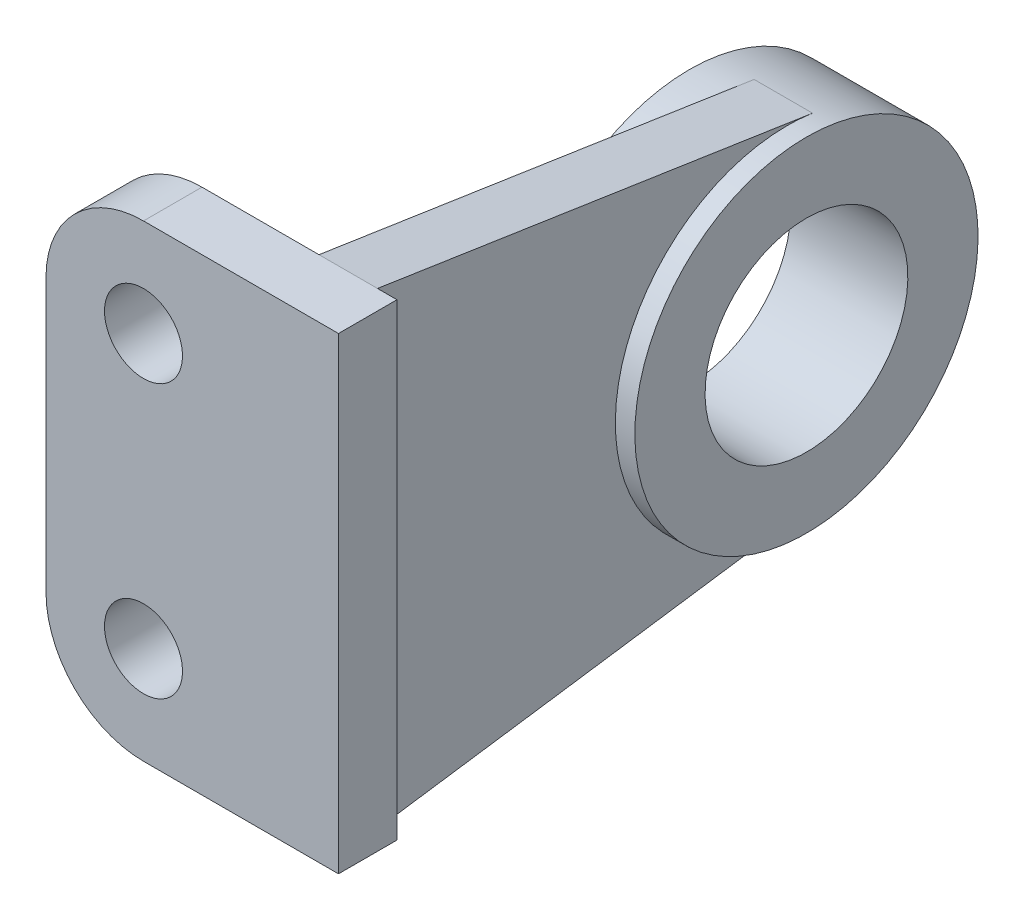
from build123d import *
from build123d.topology import SkipClean

# Parameters (mm, degrees)
BOSS_EXTRUDE1_DEPTH              = 15
BOSS_EXTRUDE2_START              = -5
SKETCH2_R                        = 26
BOSS_EXTRUDE2_DEPTH              = 15
BOSS_EXTRUDE4_DEPTH              = 5
BOSS_EXTRUDE4_DEPTH_BACK         = 25
SKETCH3_R                        = 44
SKETCH3_R_2                      = 26
TAP_DRILL_FOR_M8_TAP1_AT_2_COUNT = 2
TAP_DRILL_FOR_M8_TAP1_AT_2_PITCH = 49.497474683
TAP_DRILL_FOR_M8_TAP1_AT_3_COUNT = 2
TAP_DRILL_FOR_M8_TAP1_AT_3_PITCH = 70
TAP_DRILL_FOR_M8_TAP1_AT_4_COUNT = 2
TAP_DRILL_FOR_M8_TAP1_AT_4_PITCH = 49.497474683
SKETCH9_R                        = 17
BOSS_EXTRUDE6_DEPTH              = 5
SKETCH10_R                       = 10
CUT_EXTRUDE1_DEPTH               = 161.443915435
FILLET2_R                        = 3


with BuildPart() as part:
    # Sketch1 → Boss-Extrude1 (new body)
    with BuildSketch(Plane.XY):
        with BuildLine():
            Line((37.5, 60), (-12.5, 60))
            ThreePointArc((-12.5, 60), (-30.17766953, 52.67766953), (-37.5, 35))
            Line((-37.5, 35), (-37.5, -35))
            ThreePointArc((-37.5, -35), (-30.17766953, -52.67766953), (-12.5, -60))
            Line((-12.5, -60), (37.5, -60))
            Line((37.5, -60), (37.5, 60))
        make_face()
    extrude(amount=BOSS_EXTRUDE1_DEPTH)

    # Sketch9 → Boss-Extrude6 (add)
    with BuildSketch(Plane(origin=(0, 0, 0), x_dir=(-1, 0, 0), z_dir=(0, 0, -1))):
        with Locations((12.5, 35)):
            Circle(SKETCH9_R)
        with Locations((12.5, -35)):
            Circle(SKETCH9_R)
    extrude(amount=BOSS_EXTRUDE6_DEPTH)

    # Sketch10 → Cut-Extrude1 (cut, through all)
    with BuildSketch(Plane(origin=(0, 0, -5), x_dir=(-1, 0, 0), z_dir=(0, 0, -1))):
        with Locations((12.5, 35)):
            Circle(SKETCH10_R)
        with Locations((12.5, -35)):
            Circle(SKETCH10_R)
    extrude(amount=-CUT_EXTRUDE1_DEPTH, mode=Mode.SUBTRACT)

    # Fillet2
    fillet2_edges = [part.edges().sort_by_distance(p)[0] for p in [
        (4.5, 35, 0),
        (4.5, -35, 0),
    ]]
    fillet(fillet2_edges, radius=FILLET2_R)


with BuildPart() as body_2:
    # Sketch2 → Boss-Extrude2 (new body)
    with BuildSketch(Plane(origin=(37.5, 0, 0), x_dir=(0, 0, -1), z_dir=(1, 0, 0)).offset(BOSS_EXTRUDE2_START)):
        with BuildLine():
            Line((111.575118355, 43.137488486), (0, 60))
            Line((0, 60), (0, -60))
            Line((0, -60), (111.293427104, -43.916055117))
            ThreePointArc((111.293427104, -43.916055117), (148.999769647, -0.510839215), (111.575118355, 43.137488486))
        make_face()
        with Locations((105, -0.368463045)):
            Circle(SKETCH2_R, mode=Mode.SUBTRACT)
    extrude(amount=-BOSS_EXTRUDE2_DEPTH)

    # Sketch3 → Boss-Extrude4 (add, two sides: drawn at the far end of the back side and taken through both)
    with SkipClean():  # the faces are left unmerged after this step: merging them gives an invalid solid
        with BuildSketch(Plane(origin=(32.5, 0, 0), x_dir=(0, 0, -1), z_dir=(1, 0, 0)).offset(-BOSS_EXTRUDE4_DEPTH_BACK)):
            with Locations((105, -0.368463045)):
                Circle(SKETCH3_R)
            with Locations((105, -0.368463045)):
                Circle(SKETCH3_R_2, mode=Mode.SUBTRACT)
        extrude(amount=BOSS_EXTRUDE4_DEPTH + BOSS_EXTRUDE4_DEPTH_BACK)

    # Sketch5 → Tap Drill for M8 Tap1 (revolve, cut)
    with SkipClean():  # the faces are left unmerged after this step: merging them gives an invalid solid
        with BuildSketch(Plane(origin=(7.5, -0.368463045, -140), x_dir=(0, 0, 1), z_dir=(0, 1, 0))):
            Polygon((0, 0), (0, 18.042926105), (3.4, 16), (3.4, 0), align=None)
        tap_drill_for_m8_tap1 = revolve(axis=Axis((1.15, -0.368463045, -140), (1, 0, 0)), mode=Mode.SUBTRACT)

    # Tap Drill for M8 Tap1 at 2: Tap Drill for M8 Tap1 ×2
    with SkipClean():  # the faces are left unmerged after this step: merging them gives an invalid solid
        with Locations(*[Vector(0, 0.7071067811865477, 0.7071067811865475) * (i * TAP_DRILL_FOR_M8_TAP1_AT_2_PITCH) for i in range(1, TAP_DRILL_FOR_M8_TAP1_AT_2_COUNT)]):
            add(tap_drill_for_m8_tap1, mode=Mode.SUBTRACT)

    # Tap Drill for M8 Tap1 at 3: Tap Drill for M8 Tap1 ×2
    with SkipClean():  # the faces are left unmerged after this step: merging them gives an invalid solid
        with Locations(*[(0, 0, i * TAP_DRILL_FOR_M8_TAP1_AT_3_PITCH) for i in range(1, TAP_DRILL_FOR_M8_TAP1_AT_3_COUNT)]):
            add(tap_drill_for_m8_tap1, mode=Mode.SUBTRACT)

    # Tap Drill for M8 Tap1 at 4: Tap Drill for M8 Tap1 ×2
    with SkipClean():  # the faces are left unmerged after this step: merging them gives an invalid solid
        with Locations(*[Vector(0, -0.7071067811865476, 0.7071067811865476) * (i * TAP_DRILL_FOR_M8_TAP1_AT_4_PITCH) for i in range(1, TAP_DRILL_FOR_M8_TAP1_AT_4_COUNT)]):
            add(tap_drill_for_m8_tap1, mode=Mode.SUBTRACT)


solid = Compound([part.part, body_2.part])
